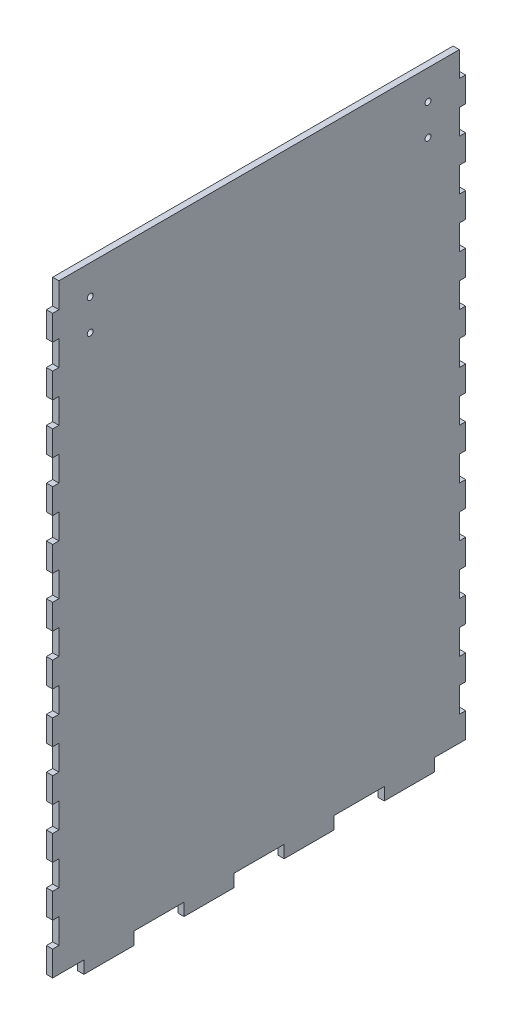
from build123d import *

# Parameters (mm, degrees)
SKETCH1_W           = 3.175
SKETCH1_H           = 12.7
SKETCH1_W_2         = 203.2
SKETCH1_H_2         = 304.8
SKETCH1_W_3         = 25.4
SKETCH1_H_3         = 6.35
BOSS_EXTRUDE1_DEPTH = 3.175
SKETCH2_R           = 1.5
CUT_EXTRUDE1_DEPTH  = 3.175


with BuildPart() as part:
    # Sketch1 → Boss-Extrude1 (new body)
    with BuildSketch(Plane(origin=(0, 0, 0), x_dir=(0, 0, -1), z_dir=(1, 0, 0))):
        with Locations((-1.5875, 285.75)):
            Rectangle(SKETCH1_W, SKETCH1_H)
        with Locations((-1.5875, 260.35)):
            Rectangle(SKETCH1_W, SKETCH1_H)
        with Locations((-1.5875, 234.95)):
            Rectangle(SKETCH1_W, SKETCH1_H)
        with Locations((-1.5875, 209.55)):
            Rectangle(SKETCH1_W, SKETCH1_H)
        with Locations((-1.5875, 184.15)):
            Rectangle(SKETCH1_W, SKETCH1_H)
        with Locations((-1.5875, 158.75)):
            Rectangle(SKETCH1_W, SKETCH1_H)
        with Locations((-1.5875, 133.35)):
            Rectangle(SKETCH1_W, SKETCH1_H)
        with Locations((-1.5875, 107.95)):
            Rectangle(SKETCH1_W, SKETCH1_H)
        with Locations((-1.5875, 82.55)):
            Rectangle(SKETCH1_W, SKETCH1_H)
        with Locations((-1.5875, 57.15)):
            Rectangle(SKETCH1_W, SKETCH1_H)
        with Locations((-1.5875, 31.75)):
            Rectangle(SKETCH1_W, SKETCH1_H)
        with Locations((101.6, 152.4)):
            Rectangle(SKETCH1_W_2, SKETCH1_H_2)
        with Locations((-1.5875, 6.35)):
            Rectangle(SKETCH1_W, SKETCH1_H)
        with Locations((25.4, -3.175)):
            Rectangle(SKETCH1_W_3, SKETCH1_H_3)
        with Locations((76.2, -3.175)):
            Rectangle(SKETCH1_W_3, SKETCH1_H_3)
        with Locations((127, -3.175)):
            Rectangle(SKETCH1_W_3, SKETCH1_H_3)
        with Locations((177.8, -3.175)):
            Rectangle(SKETCH1_W_3, SKETCH1_H_3)
        with Locations((204.7875, 6.35)):
            Rectangle(SKETCH1_W, SKETCH1_H)
        with Locations((204.7875, 31.75)):
            Rectangle(SKETCH1_W, SKETCH1_H)
        with Locations((204.7875, 57.15)):
            Rectangle(SKETCH1_W, SKETCH1_H)
        with Locations((204.7875, 82.55)):
            Rectangle(SKETCH1_W, SKETCH1_H)
        with Locations((204.7875, 107.95)):
            Rectangle(SKETCH1_W, SKETCH1_H)
        with Locations((204.7875, 133.35)):
            Rectangle(SKETCH1_W, SKETCH1_H)
        with Locations((204.7875, 158.75)):
            Rectangle(SKETCH1_W, SKETCH1_H)
        with Locations((204.7875, 184.15)):
            Rectangle(SKETCH1_W, SKETCH1_H)
        with Locations((204.7875, 209.55)):
            Rectangle(SKETCH1_W, SKETCH1_H)
        with Locations((204.7875, 234.95)):
            Rectangle(SKETCH1_W, SKETCH1_H)
        with Locations((204.7875, 260.35)):
            Rectangle(SKETCH1_W, SKETCH1_H)
        with Locations((204.7875, 285.75)):
            Rectangle(SKETCH1_W, SKETCH1_H)
    extrude(amount=BOSS_EXTRUDE1_DEPTH)

    # Sketch2 → Cut-Extrude1 (cut)
    with BuildSketch(Plane(origin=(3.175, 0, 0), x_dir=(0, 0, -1), z_dir=(1, 0, 0))):
        with Locations((15.875, 289.8)):
            Circle(SKETCH2_R)
        with Locations((15.875, 274.05)):
            Circle(SKETCH2_R)
        with Locations((187.325, 274.05)):
            Circle(SKETCH2_R)
        with Locations((187.325, 289.8)):
            Circle(SKETCH2_R)
    extrude(amount=-CUT_EXTRUDE1_DEPTH, mode=Mode.SUBTRACT)


solid = part.part
